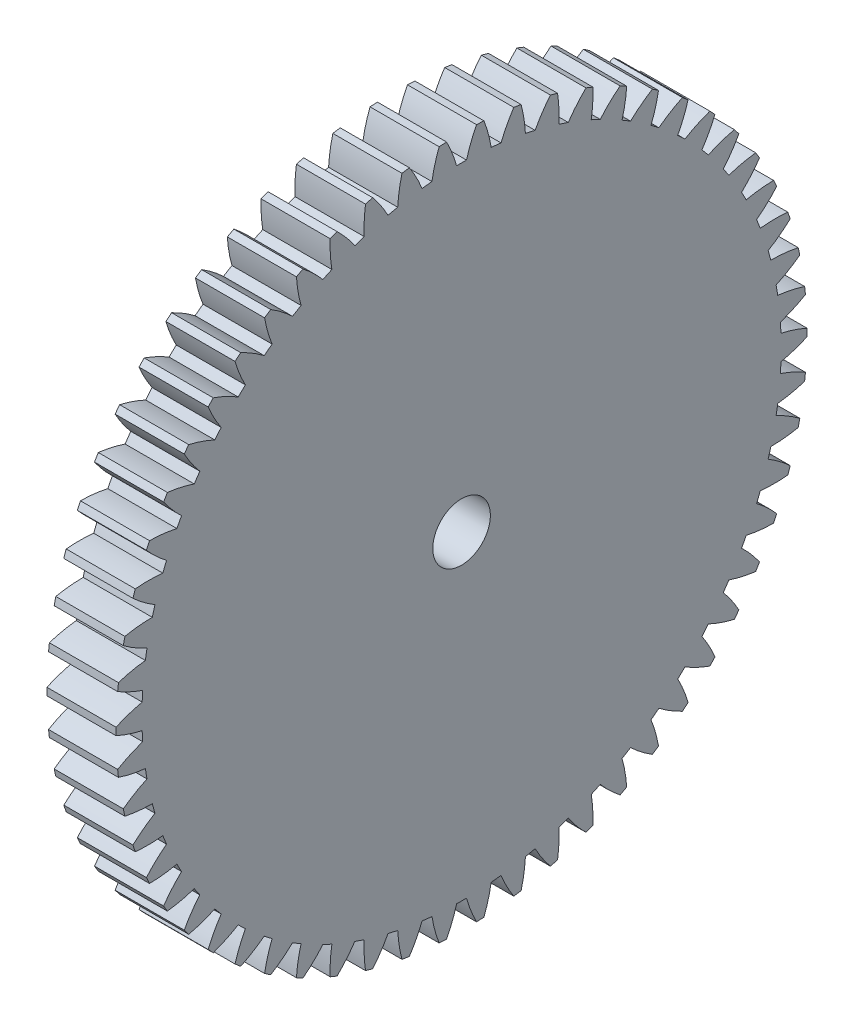
from build123d import *

# Parameters (mm, degrees)
BASPROSKE_W     = 6
BASPROSKE_H     = 30
TOOTHCUT_DEPTH  = 43.848570571
TEETHCUTS_COUNT = 58
TEETHCUTS_ANGLE = 353.793103448
BORSKE_R        = 2.5
BORE_DEPTH      = 50.0000508


with BuildPart() as part:
    # BasProSke → Base-Revolve (revolve)
    with BuildSketch(Plane(origin=(0, 0, 0), x_dir=(1, 0, 0), z_dir=(0, 1, 0)), mode=Mode.PRIVATE) as base_revolve_sk:
        with Locations((3, 15)):
            Rectangle(BASPROSKE_W, BASPROSKE_H)
    revolve(base_revolve_sk.sketch.rotate(Axis((-10, 0, 0), (1, 0, 0)), 180), axis=Axis((-10, 0, 0), (1, 0, 0)))

    # TooCutSke → ToothCut (cut, through all)
    with BuildSketch(Plane(origin=(0, 0, 0), x_dir=(0, 0, -1), z_dir=(1, 0, 0))):
        with BuildLine():
            ThreePointArc((0.431457278, 27.745645525), (0, 27.749), (-0.431457278, 27.745645525))
            ThreePointArc((-0.431457278, 27.745645525), (-0.814693207, 28.894207795), (-1.315565323, 29.996565354))
            ThreePointArc((-1.315565323, 29.996565354), (0, 30.0254), (1.315565323, 29.996565354))
            ThreePointArc((1.315565323, 29.996565354), (0.814693207, 28.894207795), (0.431457278, 27.745645525))
        make_face()
    toothcut = extrude(amount=TOOTHCUT_DEPTH, mode=Mode.SUBTRACT)

    # TeethCuts: ToothCut ×58 about axis
    teethcuts_axis = Axis((-10, 0, 0), (1, 0, 0))
    for i in range(1, TEETHCUTS_COUNT):
        add(toothcut.rotate(teethcuts_axis, i * TEETHCUTS_ANGLE / (TEETHCUTS_COUNT - 1)), mode=Mode.SUBTRACT)

    # BorSke → Bore (cut, symmetric)
    with BuildSketch(Plane(origin=(0, 0, 0), x_dir=(0, 0, -1), z_dir=(1, 0, 0))):
        with Locations(Location((0, 0, 0), (0, 0, 180))):
            Circle(BORSKE_R)
    extrude(amount=BORE_DEPTH, both=True, mode=Mode.SUBTRACT)


solid = part.part
